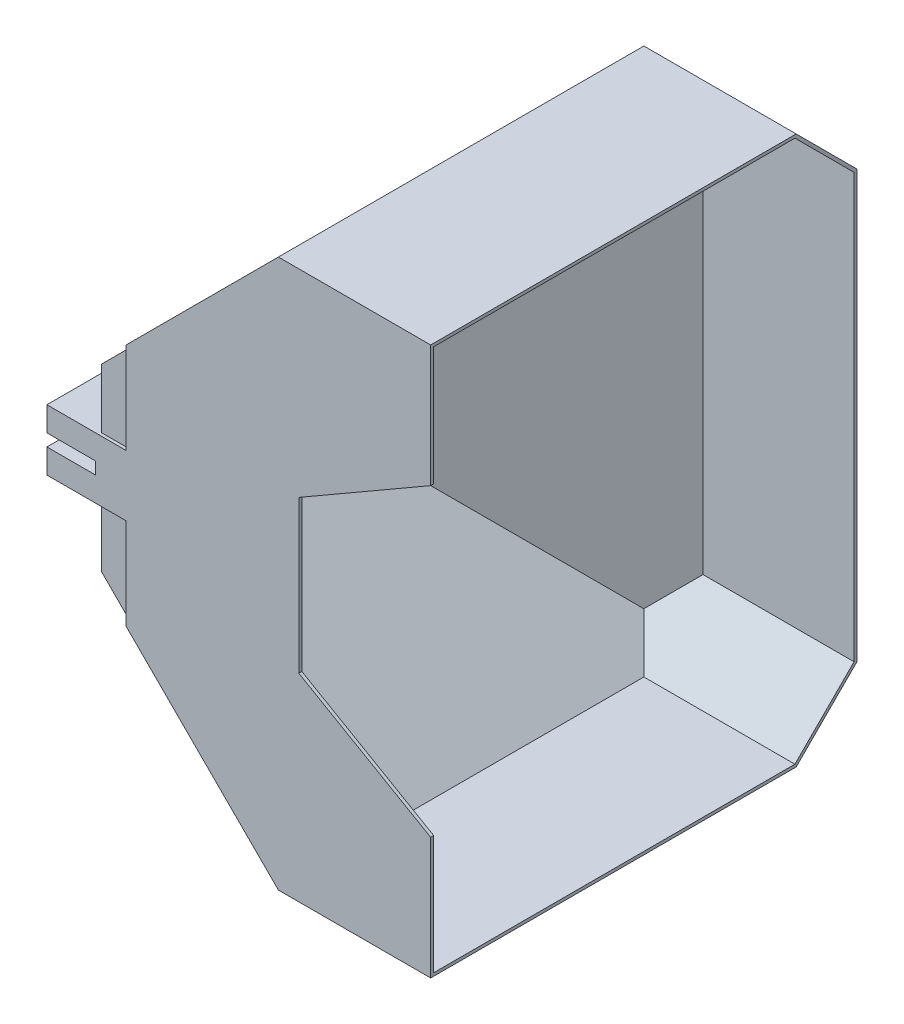
from build123d import *

# Parameters (mm, degrees)
SKETCH1_W           = 55
SKETCH1_H           = 70
BOSS_EXTRUDE1_DEPTH = 90
CHAMFER1_SIZE       = 30
CHAMFER2_SIZE       = 30
CHAMFER3_SIZE       = 10
SHELL1_T            = -0.5
SKETCH2_W           = 20
SKETCH2_H           = 5
BOSS_EXTRUDE2_DEPTH = 8
FILLET1_R           = 5
SKETCH3_W           = 30
SKETCH3_H           = 2
CUT_EXTRUDE1_DEPTH  = 8
CHAMFER5_SIZE       = 5
CUT_EXTRUDE2_DEPTH  = 5


with BuildPart() as part:
    # Sketch1 → Boss-Extrude1 (new body)
    with BuildSketch(Plane(origin=(0, 0, 0), x_dir=(1, 0, 0), z_dir=(0, 1, 0))):
        Rectangle(SKETCH1_W, SKETCH1_H)
    extrude(amount=BOSS_EXTRUDE1_DEPTH)

    # Chamfer1
    chamfer1_edges = [part.edges().sort_by_distance(p)[0] for p in [
        (-27.5, 45, -35),
    ]]
    chamfer(chamfer1_edges, length=CHAMFER1_SIZE)

    # Chamfer2
    chamfer2_edges = [part.edges().sort_by_distance(p)[0] for p in [
        (-27.5, 0, 15),
        (-27.5, 90, 15),
    ]]
    chamfer(chamfer2_edges, length=CHAMFER2_SIZE)

    # Chamfer3
    chamfer3_edges = [part.edges().sort_by_distance(p)[0] for p in [
        (15, 0, -35),
        (15, 90, -35),
    ]]
    chamfer(chamfer3_edges, length=CHAMFER3_SIZE)

    # Shell1
    shell1_openings = [part.faces().sort_by_distance(p)[0] for p in [
        (27.5, 45, 0.510752688),
    ]]
    offset(amount=SHELL1_T, openings=shell1_openings, kind=Kind.INTERSECTION)

    # Sketch2 → Boss-Extrude2 (add)
    with BuildSketch(Plane.ZY.offset(27.5)):
        with Locations((25, 47.5)):
            Rectangle(SKETCH2_W, SKETCH2_H)
        with Locations((25, 42.5)):
            Rectangle(SKETCH2_W, SKETCH2_H)
    extrude(amount=BOSS_EXTRUDE2_DEPTH)

    # Fillet1
    fillet1_edges = [part.edges().sort_by_distance(p)[0] for p in [
        (-35.5, 45, 15),
    ]]
    fillet(fillet1_edges, radius=FILLET1_R)

    # Sketch3 → Cut-Extrude1 (cut)
    with BuildSketch(Plane.ZY.offset(35.5)):
        with Locations((35, 45)):
            Rectangle(SKETCH3_W, SKETCH3_H)
    extrude(amount=-CUT_EXTRUDE1_DEPTH, mode=Mode.SUBTRACT)

    # Chamfer5
    chamfer5_edges = [part.edges().sort_by_distance(p)[0] for p in [
        (-27.5, 55, 35),
        (-27.5, 35, 35),
    ]]
    chamfer(chamfer5_edges, length=CHAMFER5_SIZE)

    # Sketch4 → Cut-Extrude2 (cut, symmetric)
    with BuildSketch(Plane(origin=(0, 0, 34.5), x_dir=(-1, 0, 0), z_dir=(0, 0, -1))):
        Polygon((-27.5, 70), (-49.150635095, 57.5), (-49.150635095, 32.5), (-27.5, 20), (-5.849364905, 32.5), (-5.849364905, 57.5), align=None)
    extrude(amount=CUT_EXTRUDE2_DEPTH, both=True, mode=Mode.SUBTRACT)


solid = part.part
